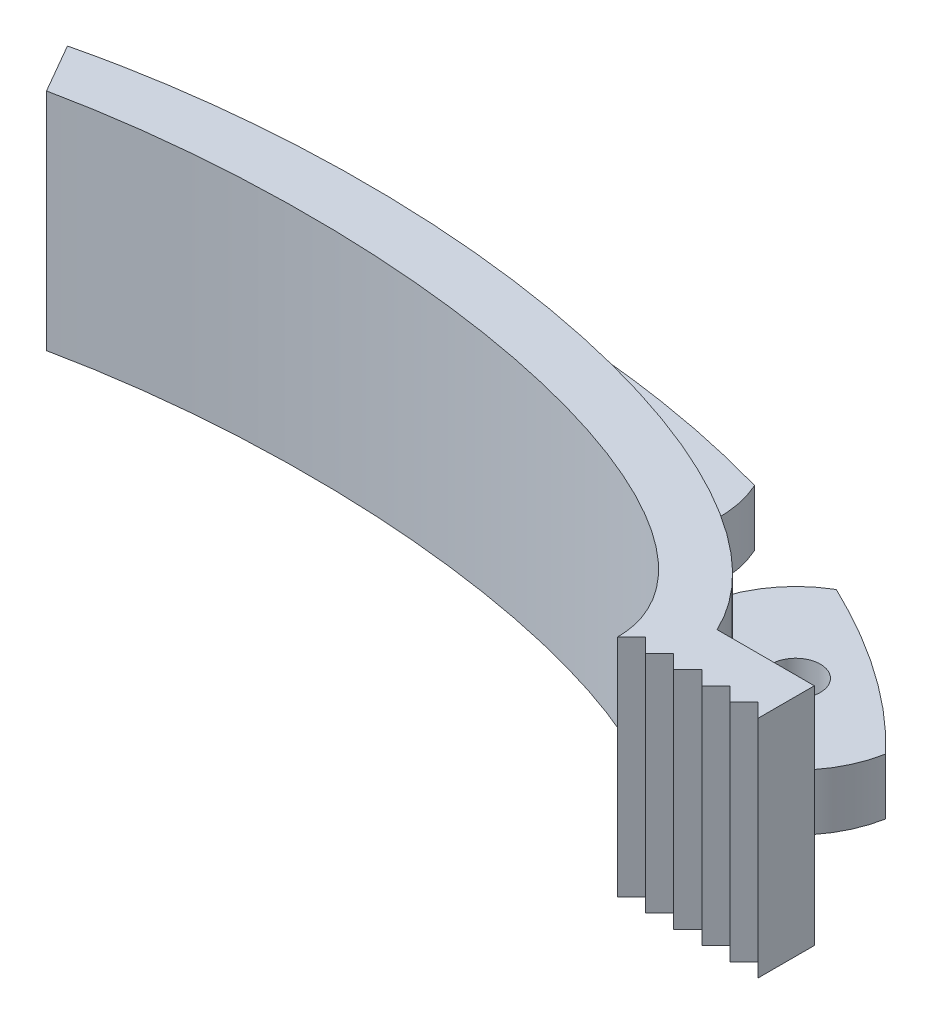
from build123d import *

# Parameters (mm, degrees)
SKETCH_1_R           = 1.75
EXTRUDE_1_DEPTH      = 4
EXTRUDE_2_DEPTH      = 12
EXTRUDE_2_DEPTH_BACK = 4
SKETCH_3_RX          = 67.635215972
SKETCH_3_RY          = 42.561403697
SKETCH_3_RX_2        = 48
SKETCH_3_RY_2        = 29
CUT_EXTRUDE_1_DEPTH  = 58.533572984


with BuildPart() as part:
    # Эскиз1 → Бобышка-Вытянуть1 (new body)
    with BuildSketch(Plane(origin=(0, 0, 0), x_dir=(1, 0, 0), z_dir=(0, 1, 0))):
        with BuildLine():
            Line((-20.174303771, 18.942924546), (-18.965402515, 16.84506463))
            add(Edge.make_bspline(
                [(40.081115814, 4), (28.750564553, 28.382056896), (-18.965402515, 16.84506463)],
                knots=[3.353705964, 3.353705964, 3.353705964, 5.193281659, 5.193281659, 5.193281659], degree=2, weights=[1, 0.605988932, 1]))
            Line((40.081115814, 4), (42.267431178, 4))
            add(Edge.make_bspline(
                [(42.267431178, 4), (41.217865879, 6.840819881), (38.739700818, 9.444538848)],
                knots=[0.184851718, 0.184851718, 0.184851718, 0.44890402, 0.44890402, 0.44890402], degree=2, weights=[1, 0.9912972, 1]))
            ThreePointArc((38.739700818, 9.444538848), (38.091362137, 22.597313653), (26.024371113, 17.32440594))
            add(Edge.make_bspline(
                [(26.024371113, 17.32440594), (23.311300844, 18.368335767), (20.30717858, 19.182928724)],
                knots=[0.920756723, 0.920756723, 0.920756723, 1.078943412, 1.078943412, 1.078943412], degree=2, weights=[1, 0.996873752, 1]))
            ThreePointArc((20.30717858, 19.182928724), (14.516083792, 30.835250875), (5.356526294, 21.593178771))
            add(Edge.make_bspline(
                [(5.356526294, 21.593178771), (0, 21.933538582), (-5.356526294, 21.593178771)],
                knots=[1.445901501, 1.445901501, 1.445901501, 1.695691152, 1.695691152, 1.695691152], degree=2, weights=[1, 0.992210774, 1]))
            ThreePointArc((-5.356526294, 21.593178771), (-14.651313877, 30.81225876), (-20.174303771, 18.942924546))
        make_face()
        with Locations(Location((33.877249978, 15.797221102, 0), (0, 0, 270))):
            Circle(SKETCH_1_R, mode=Mode.SUBTRACT)
        with Locations(Location((13.24281407, 22.937226804, 0), (0, 0, 270))):
            Circle(SKETCH_1_R, mode=Mode.SUBTRACT)
        with Locations(Location((-13.24281407, 22.937226804, 0), (0, 0, 270))):
            Circle(SKETCH_1_R, mode=Mode.SUBTRACT)
    extrude(amount=EXTRUDE_1_DEPTH)

    # Эскиз3 → Вырез-Вытянуть1 (cut, through all)
    with BuildSketch(Plane(origin=(0, 4, 0), x_dir=(1, 0, 0), z_dir=(0, 1, 0))):
        with Locations(Location((0, 0), (0, 0, 180))):
            Ellipse(SKETCH_3_RX, SKETCH_3_RY)
        with Locations(Location((0, 0), (0, 0, 180))):
            Ellipse(SKETCH_3_RX_2, SKETCH_3_RY_2, mode=Mode.SUBTRACT)
    extrude(amount=-CUT_EXTRUDE_1_DEPTH, mode=Mode.SUBTRACT)


with BuildPart() as body_2:
    # Эскиз2 → Бобышка-Вытянуть2 (new, two sides: drawn at the far end of the back side and taken through both)
    with BuildSketch(Plane(origin=(0, 4, 0), x_dir=(1, 0, 0), z_dir=(0, 1, 0)).offset(-EXTRUDE_2_DEPTH_BACK)):
        with BuildLine():
            Line((47, 0), (47, 4))
            Line((47, 4), (40.081115814, 4))
            add(Edge.make_bspline(
                [(40.081115814, 4), (28.750564553, 28.382056896), (-18.965402515, 16.84506463)],
                knots=[3.353705964, 3.353705964, 3.353705964, 5.193281659, 5.193281659, 5.193281659], degree=2, weights=[1, 0.605988932, 1]))
            Line((-18.965402515, 16.84506463), (-16.942696267, 13.334972849))
            add(Edge.make_bspline(
                [(37, 0), (37, 24.599218419), (-16.942696267, 13.334972849)],
                knots=[3.141592654, 3.141592654, 3.141592654, 5.18803259, 5.18803259, 5.18803259], degree=2, weights=[1, 0.520619482, 1]))
            Line((37, 0), (38, 1))
            Line((38, 1), (39, 0))
            Line((39, 0), (40, 1))
            Line((40, 1), (41, 0))
            Line((41, 0), (42, 1))
            Line((42, 1), (43, 0))
            Line((43, 0), (44, 1))
            Line((44, 1), (45, 0))
            Line((45, 0), (46, 1))
            Line((46, 1), (47, 0))
        make_face()
    extrude(amount=EXTRUDE_2_DEPTH + EXTRUDE_2_DEPTH_BACK)


solid = Compound([part.part, body_2.part])
